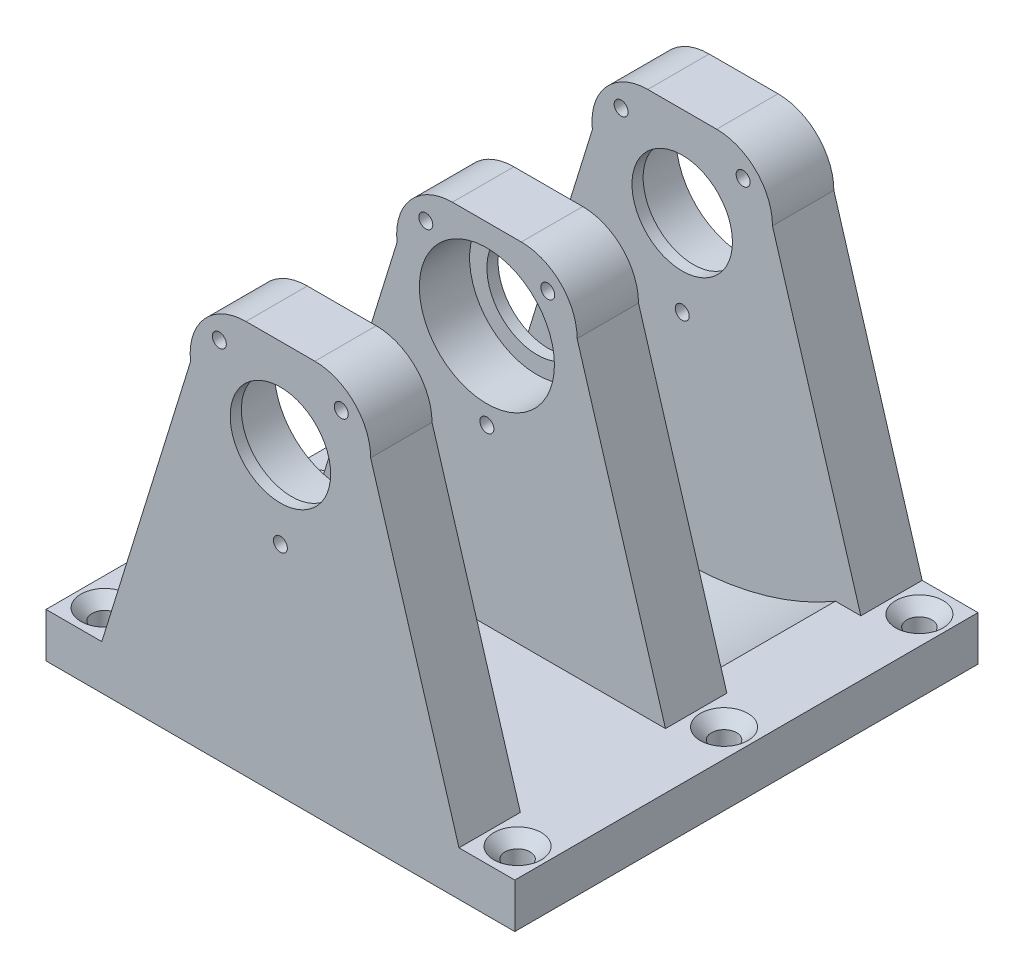
from build123d import *

# Parameters (mm, degrees)
SCHIZZO1_R                    = 12.1
ESTRUSIONE_ESTRUSIONE1_DEPTH  = 11
ESTRUSIONE_ESTRUSIONE2_START  = -2
SCHIZZO2_R                    = 12.1
SCHIZZO2_R_2                  = 9
ESTRUSIONE_ESTRUSIONE2_DEPTH  = 2
SCHIZZO3_R                    = 2.25
TAGLIO_ESTRUSIONE1_DEPTH      = 77.182412669
SMUSSO1_SIZE                  = 2
SCHIZZO4_R                    = 1.25
TAGLIO_ESTRUSIONE2_DEPTH      = 70.679623994
ESTRUSIONE_ESTRUSIONE4_DEPTH  = 24
SCHIZZO7_R                    = 1.25
SCHIZZO7_R_2                  = 9
ESTRUSIONE_ESTRUSIONE5_DEPTH  = 2
SCHIZZO8_R                    = 12.1
SCHIZZO8_R_2                  = 1.25
ESTRUSIONE_ESTRUSIONE6_DEPTH  = 9
SCHIZZO10_W                   = 84
SCHIZZO10_H                   = 8
ESTRUSIONE_ESTRUSIONE8_DEPTH  = 26
SCHIZZO11_W                   = 84
SCHIZZO11_H                   = 8
SCHIZZO11_R                   = 1.25
SCHIZZO11_R_2                 = 12.1
ESTRUSIONE_ESTRUSIONE9_DEPTH  = 9
SCHIZZO12_R                   = 1.25
SCHIZZO12_R_2                 = 9
ESTRUSIONE_ESTRUSIONE10_DEPTH = 2
TAGLIO_ESTRUSIONE3_DEPTH      = 113.123860083
SMUSSO2_SIZE                  = 2


with BuildPart() as part:
    # Schizzo1 → Estrusione-Estrusione1 (new body)
    with BuildSketch(Plane.XY):
        with BuildLine():
            Line((-6.171311325, 16.1), (6.171311325, 16.1))
            ThreePointArc((6.171311325, 16.1), (13.242379137, 13.171067812), (16.171311325, 6.1))
            Line((16.171311325, 6.1), (32, -46.5))
            Line((32, -46.5), (42, -46.5))
            Line((42, -46.5), (42, -54.5))
            Line((42, -54.5), (17, -54.5))
            Line((17, -54.5), (-17, -54.5))
            Line((-17, -54.5), (-42, -54.5))
            Line((-42, -54.5), (-42, -46.5))
            Line((-42, -46.5), (-32, -46.5))
            Line((-32, -46.5), (-16.1, 4.907883736))
            ThreePointArc((-16.1, 4.907883736), (-13.651991863, 12.73622021), (-6.171311325, 16.1))
        make_face()
        Circle(SCHIZZO1_R, mode=Mode.SUBTRACT)
    extrude(amount=ESTRUSIONE_ESTRUSIONE1_DEPTH)

    # Schizzo2 → Estrusione-Estrusione2 (add)
    with BuildSketch(Plane.XY.offset(11).offset(ESTRUSIONE_ESTRUSIONE2_START)):
        Circle(SCHIZZO2_R)
        Circle(SCHIZZO2_R_2, mode=Mode.SUBTRACT)
    extrude(amount=ESTRUSIONE_ESTRUSIONE2_DEPTH)

    # Schizzo3 → Taglio-Estrusione1 (cut, through all)
    with BuildSketch(Plane(origin=(0, -46.5, 0), x_dir=(1, 0, 0), z_dir=(0, 1, 0))):
        with Locations(Location((37, -5.5, 0), (0, 0, 270))):
            Circle(SCHIZZO3_R)
        with Locations(Location((-37, -5.5, 0), (0, 0, 270))):
            Circle(SCHIZZO3_R)
    extrude(amount=-TAGLIO_ESTRUSIONE1_DEPTH, mode=Mode.SUBTRACT)

    # Smusso1
    smusso1_edges = [part.edges().sort_by_distance(p)[0] for p in [
        (37, -46.5, 3.25),
        (-37, -46.5, 3.25),
    ]]
    chamfer(smusso1_edges, length=SMUSSO1_SIZE)

    # Schizzo4 → Taglio-Estrusione2 (cut, through all)
    with BuildSketch(Plane(origin=(0, 0, 0), x_dir=(-1, 0, 0), z_dir=(0, 0, -1))):
        with Locations((-10.910719744, 10.851964601)):
            Circle(SCHIZZO4_R)
        with Locations((10.944459062, 10.817992606)):
            Circle(SCHIZZO4_R)
        with Locations((0, -15.38859776)):
            Circle(SCHIZZO4_R)
    extrude(amount=-TAGLIO_ESTRUSIONE2_DEPTH, mode=Mode.SUBTRACT)

    # Schizzo5 → Estrusione-Estrusione4 (add)
    with BuildSketch(Plane.XY.offset(11)):
        with BuildLine():
            Line((-32, -46.5), (-42, -46.5))
            Line((-42, -46.5), (-42, -54.5))
            Line((-42, -54.5), (42, -54.5))
            Line((42, -54.5), (42, -46.5))
            Line((42, -46.5), (32, -46.5))
            Line((32, -46.5), (27.454507827, -46.5))
            ThreePointArc((27.454507827, -46.5), (0, -54), (-27.454507827, -46.5))
            Line((-27.454507827, -46.5), (-32, -46.5))
        make_face()
    extrude(amount=ESTRUSIONE_ESTRUSIONE4_DEPTH)

    # Schizzo7 → Estrusione-Estrusione5 (add)
    with BuildSketch(Plane.XY.offset(35)):
        with BuildLine():
            Line((42, -54.5), (42, -46.5))
            Line((42, -46.5), (32, -46.5))
            Line((32, -46.5), (16.171311325, 6.1))
            ThreePointArc((16.171311325, 6.1), (13.242379137, 13.171067812), (6.171311325, 16.1))
            Line((6.171311325, 16.1), (-6.171311325, 16.1))
            ThreePointArc((-6.171311325, 16.1), (-13.651991863, 12.73622021), (-16.1, 4.907883736))
            Line((-16.1, 4.907883736), (-32, -46.5))
            Line((-32, -46.5), (-42, -46.5))
            Line((-42, -46.5), (-42, -54.5))
            Line((-42, -54.5), (42, -54.5))
        make_face()
        with Locations(Location((10.910719744, 10.851964601, 0), (0, 0, 180))):
            Circle(SCHIZZO7_R, mode=Mode.SUBTRACT)
        Circle(SCHIZZO7_R_2, mode=Mode.SUBTRACT)
        with Locations(Location((0, -15.38859776, 0), (0, 0, 180))):
            Circle(SCHIZZO7_R, mode=Mode.SUBTRACT)
        with Locations(Location((-10.944459062, 10.817992606, 0), (0, 0, 180))):
            Circle(SCHIZZO7_R, mode=Mode.SUBTRACT)
    extrude(amount=ESTRUSIONE_ESTRUSIONE5_DEPTH)

    # Schizzo8 → Estrusione-Estrusione6 (add)
    with BuildSketch(Plane.XY.offset(37)):
        with BuildLine():
            Line((42, -46.5), (32, -46.5))
            Line((32, -46.5), (16.171311325, 6.1))
            ThreePointArc((16.171311325, 6.1), (13.242379137, 13.171067812), (6.171311325, 16.1))
            Line((6.171311325, 16.1), (-6.171311325, 16.1))
            ThreePointArc((-6.171311325, 16.1), (-13.651991863, 12.73622021), (-16.1, 4.907883736))
            Line((-16.1, 4.907883736), (-32, -46.5))
            Line((-32, -46.5), (-42, -46.5))
            Line((-42, -46.5), (-42, -54.5))
            Line((-42, -54.5), (42, -54.5))
            Line((42, -54.5), (42, -46.5))
        make_face()
        Circle(SCHIZZO8_R, mode=Mode.SUBTRACT)
        with Locations(Location((10.910719744, 10.851964601, 0), (0, 0, 180))):
            Circle(SCHIZZO8_R_2, mode=Mode.SUBTRACT)
        with Locations(Location((0, -15.38859776, 0), (0, 0, 180))):
            Circle(SCHIZZO8_R_2, mode=Mode.SUBTRACT)
        with Locations(Location((-10.944459062, 10.817992606, 0), (0, 0, 180))):
            Circle(SCHIZZO8_R_2, mode=Mode.SUBTRACT)
    extrude(amount=ESTRUSIONE_ESTRUSIONE6_DEPTH)

    # Schizzo10 → Estrusione-Estrusione8 (add)
    with BuildSketch(Plane.XY.offset(46)):
        with Locations((0, -50.5)):
            Rectangle(SCHIZZO10_W, SCHIZZO10_H)
    extrude(amount=ESTRUSIONE_ESTRUSIONE8_DEPTH)

    # Schizzo11 → Estrusione-Estrusione9 (add)
    # profile 1 of 2: a face of its own
    with BuildSketch(Plane.XY.offset(72)):
        with Locations((0, -50.5)):
            Rectangle(SCHIZZO11_W, SCHIZZO11_H)
    # profile 2 of 2: a face of its own
    with BuildSketch(Plane.XY.offset(72)):
        with BuildLine():
            Line((-16.1, 4.907883736), (-32, -46.5))
            Line((-32, -46.5), (32, -46.5))
            Line((32, -46.5), (16.171311325, 6.1))
            ThreePointArc((16.171311325, 6.1), (13.242379137, 13.171067812), (6.171311325, 16.1))
            Line((6.171311325, 16.1), (-6.171311325, 16.1))
            ThreePointArc((-6.171311325, 16.1), (-13.651991863, 12.73622021), (-16.1, 4.907883736))
        make_face()
        with Locations(Location((-10.944459062, 10.817992606, 0), (0, 0, 180))):
            Circle(SCHIZZO11_R, mode=Mode.SUBTRACT)
        with Locations(Location((0, -15.38859776, 0), (0, 0, 180))):
            Circle(SCHIZZO11_R, mode=Mode.SUBTRACT)
        Circle(SCHIZZO11_R_2, mode=Mode.SUBTRACT)
        with Locations(Location((10.910719744, 10.851964601, 0), (0, 0, 180))):
            Circle(SCHIZZO11_R, mode=Mode.SUBTRACT)
    extrude(amount=ESTRUSIONE_ESTRUSIONE9_DEPTH)

    # Schizzo12 → Estrusione-Estrusione10 (add)
    with BuildSketch(Plane.XY.offset(81)):
        with BuildLine():
            Line((42, -46.5), (32, -46.5))
            Line((32, -46.5), (16.171311325, 6.1))
            ThreePointArc((16.171311325, 6.1), (13.242379137, 13.171067812), (6.171311325, 16.1))
            Line((6.171311325, 16.1), (-6.171311325, 16.1))
            ThreePointArc((-6.171311325, 16.1), (-13.651991863, 12.73622021), (-16.1, 4.907883736))
            Line((-16.1, 4.907883736), (-32, -46.5))
            Line((-32, -46.5), (-42, -46.5))
            Line((-42, -46.5), (-42, -54.5))
            Line((-42, -54.5), (42, -54.5))
            Line((42, -54.5), (42, -46.5))
        make_face()
        with Locations(Location((-10.944459062, 10.817992606, 0), (0, 0, 180))):
            Circle(SCHIZZO12_R, mode=Mode.SUBTRACT)
        with Locations(Location((0, -15.38859776, 0), (0, 0, 180))):
            Circle(SCHIZZO12_R, mode=Mode.SUBTRACT)
        with Locations(Location((10.910719744, 10.851964601, 0), (0, 0, 180))):
            Circle(SCHIZZO12_R, mode=Mode.SUBTRACT)
        Circle(SCHIZZO12_R_2, mode=Mode.SUBTRACT)
    extrude(amount=ESTRUSIONE_ESTRUSIONE10_DEPTH)

    # Schizzo13 → Taglio-Estrusione3 (cut, through all)
    with BuildSketch(Plane(origin=(0, -46.5, 0), x_dir=(1, 0, 0), z_dir=(0, 1, 0))):
        with BuildLine():
            ThreePointArc((38.513513786, -38.835134835), (35.335134835, -38.986486214), (35.486486214, -42.164865165))
            Line((35.486486214, -42.164865165), (38.513513786, -38.835134835))
        make_face()
        with BuildLine():
            Line((38.513513786, -38.835134835), (35.486486214, -42.164865165))
            ThreePointArc((35.486486214, -42.164865165), (37.910245566, -42.557657165), (39.25, -40.5))
            ThreePointArc((39.25, -40.5), (39.057657165, -39.589754434), (38.513513786, -38.835134835))
        make_face()
        with BuildLine():
            ThreePointArc((-34.75, -40.5), (-34.942342835, -39.589754434), (-35.486486214, -38.835134835))
            Line((-35.486486214, -38.835134835), (-38.513513786, -42.164865165))
            ThreePointArc((-38.513513786, -42.164865165), (-36.089754434, -42.557657165), (-34.75, -40.5))
        make_face()
        with BuildLine():
            Line((-38.513513786, -42.164865165), (-35.486486214, -38.835134835))
            ThreePointArc((-35.486486214, -38.835134835), (-38.664865165, -38.986486214), (-38.513513786, -42.164865165))
        make_face()
        with BuildLine():
            ThreePointArc((-34.75, -77.5), (-34.942342835, -76.589754434), (-35.486486214, -75.835134835))
            Line((-35.486486214, -75.835134835), (-38.513513786, -79.164865165))
            ThreePointArc((-38.513513786, -79.164865165), (-36.089754434, -79.557657165), (-34.75, -77.5))
        make_face()
        with BuildLine():
            Line((-38.513513786, -79.164865165), (-35.486486214, -75.835134835))
            ThreePointArc((-35.486486214, -75.835134835), (-38.664865165, -75.986486214), (-38.513513786, -79.164865165))
        make_face()
        with BuildLine():
            ThreePointArc((39.25, -77.5), (37.910245566, -75.442342835), (35.486486214, -75.835134835))
            Line((35.486486214, -75.835134835), (38.513513786, -79.164865165))
            ThreePointArc((38.513513786, -79.164865165), (39.057657165, -78.410245566), (39.25, -77.5))
        make_face()
        with BuildLine():
            Line((38.513513786, -79.164865165), (35.486486214, -75.835134835))
            ThreePointArc((35.486486214, -75.835134835), (35.335134835, -79.013513786), (38.513513786, -79.164865165))
        make_face()
    extrude(amount=-TAGLIO_ESTRUSIONE3_DEPTH, mode=Mode.SUBTRACT)

    # Smusso2
    smusso2_edges = [part.edges().sort_by_distance(p)[0] for p in [
        (35.486486214, -46.5, 75.835134835),
        (-35.486486214, -46.5, 75.835134835),
        (-35.486486214, -46.5, 38.835134835),
        (38.513513786, -46.5, 38.835134835),
    ]]
    chamfer(smusso2_edges, length=SMUSSO2_SIZE)


solid = part.part
